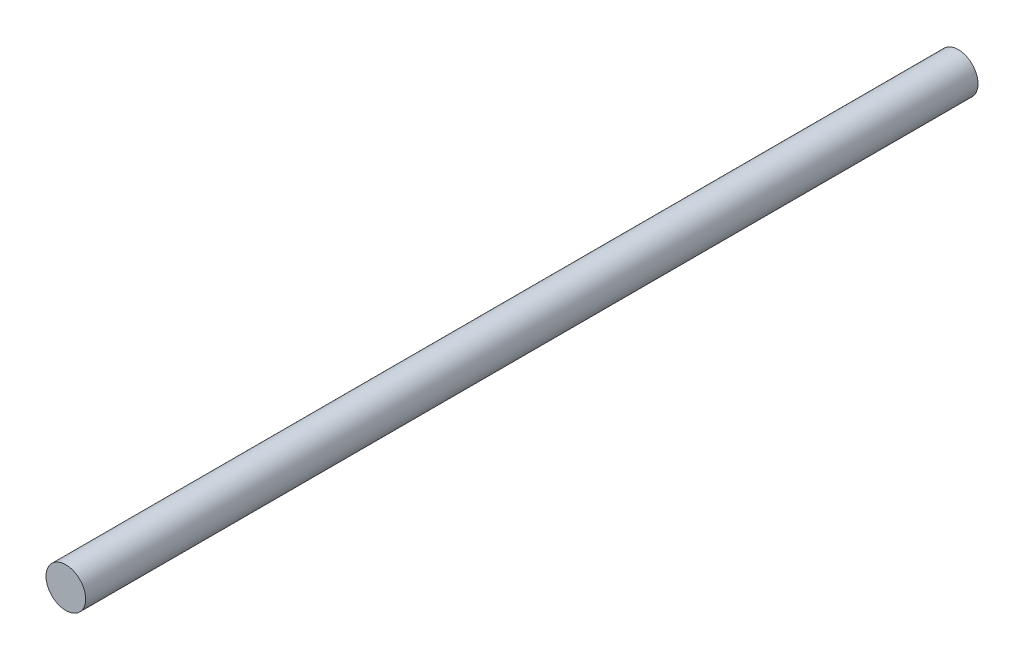
from build123d import *

# Parameters (mm, degrees)
SKETCH1_R           = 2
BOSS_EXTRUDE1_DEPTH = 90


with BuildPart() as part:
    # Sketch1 → Boss-Extrude1 (new body)
    with BuildSketch(Plane.XY):
        with Locations(Location((-0.27044182, 0, 0), (0, 0, 180))):
            Circle(SKETCH1_R)
    extrude(amount=BOSS_EXTRUDE1_DEPTH)


solid = part.part
